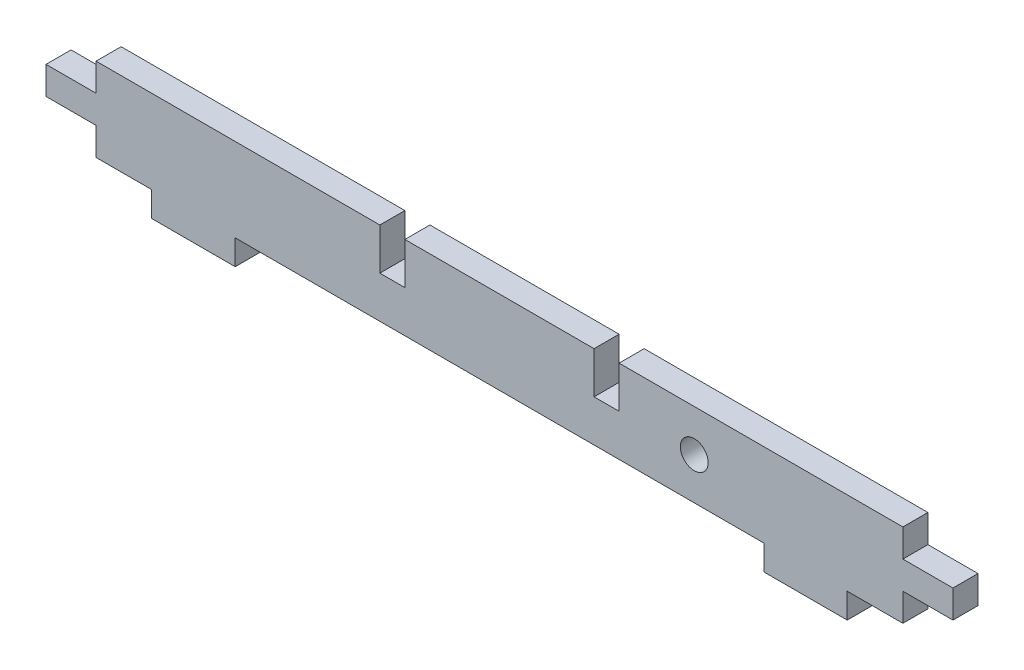
from build123d import *

# Parameters (mm, degrees)
MODEL_R             = 5
BOSS_EXTRUDE1_DEPTH = 9


with BuildPart() as part:
    # Model → Boss-Extrude1 (new body)
    with BuildSketch(Plane.XY):
        Polygon((-145, 0), (-125, 0), (-125, -9), (-95, -9), (-95, 0), (95, 0), (95, -9), (125, -9), (125, 0), (145, 0), (145, 10), (163, 10), (163, 20), (145, 20), (145, 30), (43, 30), (43, 15), (34, 15), (34, 30), (-34, 30), (-34, 15), (-43, 15), (-43, 30), (-145, 30), (-145, 20), (-163, 20), (-163, 10), (-145, 10), align=None)
        with Locations((70, 15)):
            Circle(MODEL_R, mode=Mode.SUBTRACT)
    extrude(amount=BOSS_EXTRUDE1_DEPTH)


solid = part.part
